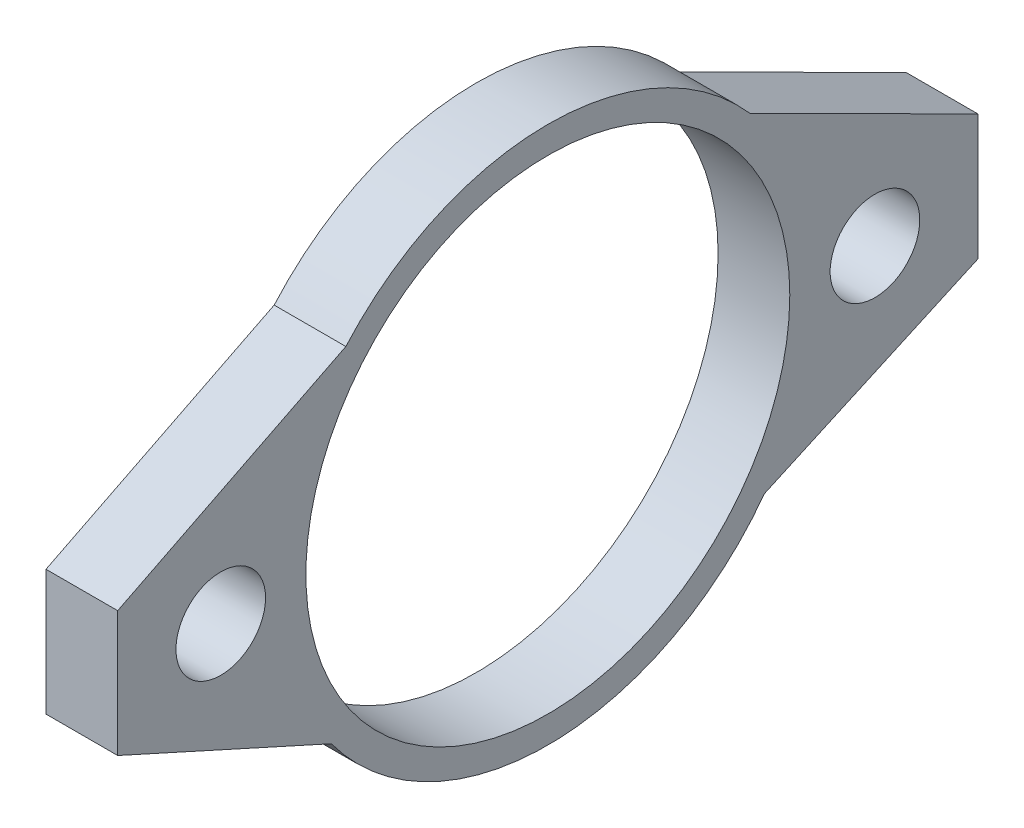
from build123d import *

# Parameters (mm, degrees)
CROQUIS1_R              = 2.5
CROQUIS1_R_2            = 13.5
SALIENTE_EXTRUIR1_DEPTH = 4


with BuildPart() as part:
    # Croquis1 → Saliente-Extruir1 (new body)
    with BuildSketch(Plane(origin=(0, 0, 0), x_dir=(0, 0, -1), z_dir=(1, 0, 0))):
        with BuildLine():
            Line((-24, 3.5), (-24, -3.5))
            Line((-24, -3.5), (-12.081640676, -8.890104532))
            ThreePointArc((-12.081640676, -8.890104532), (0, -15), (12.081640676, -8.890104532))
            Line((12.081640676, -8.890104532), (24, -3.5))
            Line((24, -3.5), (24, 3.5))
            Line((24, 3.5), (11.269745357, 9.899133275))
            ThreePointArc((11.269745357, 9.899133275), (0, 15), (-11.269745357, 9.899133275))
            Line((-11.269745357, 9.899133275), (-24, 3.5))
        make_face()
        with Locations((-18.25, 0)):
            Circle(CROQUIS1_R, mode=Mode.SUBTRACT)
        with Locations((18.25, 0)):
            Circle(CROQUIS1_R, mode=Mode.SUBTRACT)
        Circle(CROQUIS1_R_2, mode=Mode.SUBTRACT)
    extrude(amount=SALIENTE_EXTRUIR1_DEPTH)


solid = part.part
